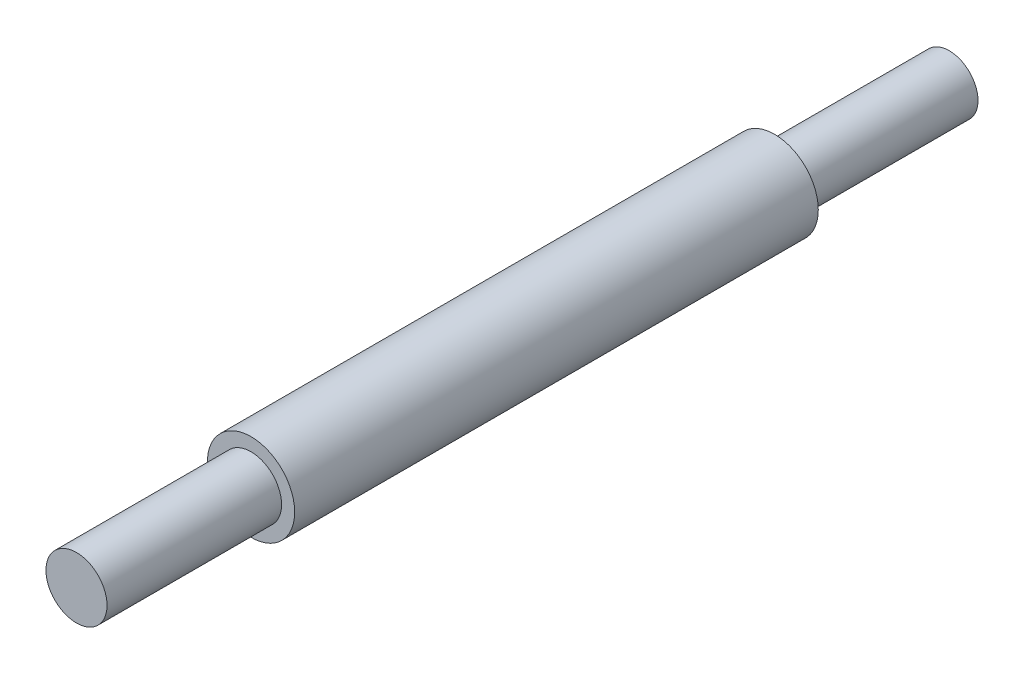
from build123d import *

# Parameters (mm, degrees)
SKETCH_1_R      = 1.65
EXTRUDE_1_DEPTH = 10
SKETCH_2_R      = 2.5
EXTRUDE_2_DEPTH = 30
SKETCH_3_R      = 1.75
EXTRUDE_3_DEPTH = 10


with BuildPart() as part:
    # 草图1 → 凸台-拉伸1 (new body)
    with BuildSketch(Plane.XY):
        Circle(SKETCH_1_R)
    extrude(amount=EXTRUDE_1_DEPTH)

    # 草图2 → 凸台-拉伸2 (add)
    with BuildSketch(Plane.XY.offset(10)):
        Circle(SKETCH_2_R)
    extrude(amount=EXTRUDE_2_DEPTH)

    # 草图3 → 凸台-拉伸3 (add)
    with BuildSketch(Plane.XY.offset(40)):
        Circle(SKETCH_3_R)
    extrude(amount=EXTRUDE_3_DEPTH)


solid = part.part
